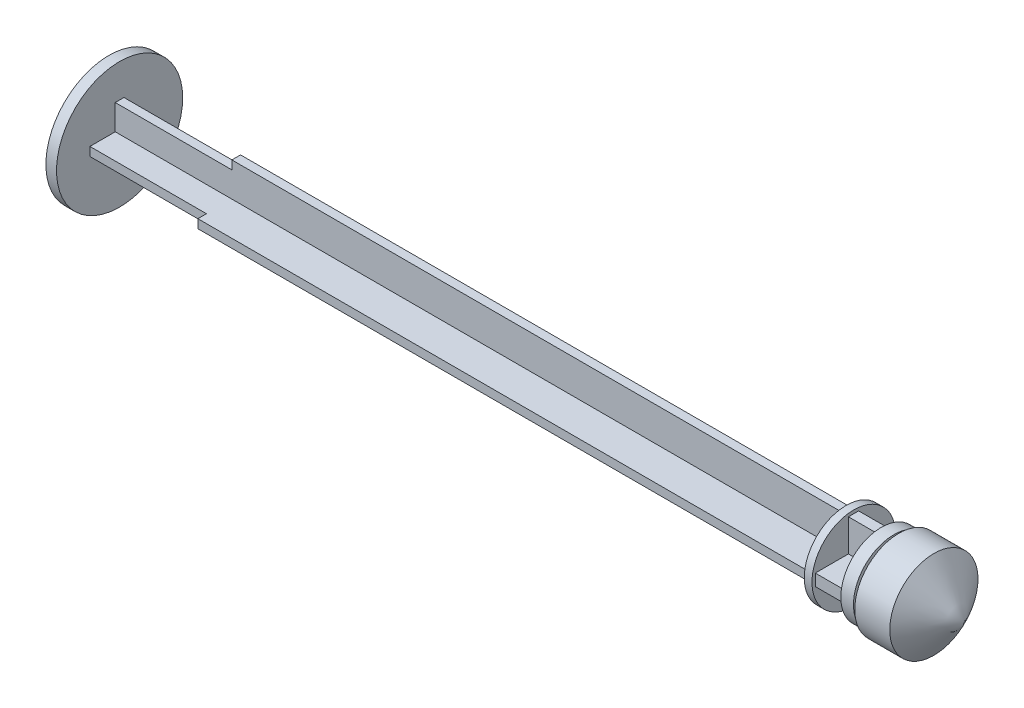
from build123d import *

# Parameters (mm, degrees)
SKETCH1_R            = 6.235
BOSS_EXTRUDE1_DEPTH  = 1.05
SKETCH2_W            = 5.87
SKETCH2_H            = 0.86
SKETCH2_W_2          = 0.86
SKETCH2_H_2          = 5.87
BOSS_EXTRUDE5_DEPTH  = 11.52
SKETCH10_W           = 0.86
SKETCH10_H           = 7.57
BOSS_EXTRUDE6_DEPTH  = 60.27
SKETCH11_W           = 7.57
SKETCH11_H           = 0.86
BOSS_EXTRUDE8_DEPTH  = 60.27
SKETCH15_R           = 4.13
BOSS_EXTRUDE9_DEPTH  = 0.76
SKETCH16_W           = 1.010303068
SKETCH16_H           = 7.6
SKETCH16_W_2         = 7.6
SKETCH16_H_2         = 1.157256242
BOSS_EXTRUDE10_DEPTH = 2.71
SKETCH17_R           = 3.99
BOSS_EXTRUDE11_DEPTH = 1.25
SKETCH18_W           = 2.18
SKETCH18_H           = 0.9
SKETCH18_W_2         = 0.9
SKETCH18_H_2         = 2.18
BOSS_EXTRUDE13_DEPTH = 0.5
SKETCH19_R           = 4.36
BOSS_EXTRUDE14_DEPTH = 3.46


with BuildPart() as part:
    # Sketch1 → Boss-Extrude1 (new body)
    with BuildSketch(Plane(origin=(0, 0, 0), x_dir=(0, 0, -1), z_dir=(1, 0, 0))):
        Circle(SKETCH1_R)
    extrude(amount=BOSS_EXTRUDE1_DEPTH)

    # Sketch2 → Boss-Extrude5 (add)
    with BuildSketch(Plane(origin=(1.05, 0, 0), x_dir=(0, 0, -1), z_dir=(1, 0, 0))):
        Rectangle(SKETCH2_W, SKETCH2_H)
        Rectangle(SKETCH2_W_2, SKETCH2_H_2)
    extrude(amount=BOSS_EXTRUDE5_DEPTH)

    # Sketch10 → Boss-Extrude6 (add)
    with BuildSketch(Plane(origin=(12.57, 0, 0), x_dir=(0, 0, -1), z_dir=(1, 0, 0))):
        Rectangle(SKETCH10_W, SKETCH10_H)
    extrude(amount=BOSS_EXTRUDE6_DEPTH)

    # Sketch11 → Boss-Extrude8 (add)
    with BuildSketch(Plane(origin=(12.57, 0, 0), x_dir=(0, 0, -1), z_dir=(1, 0, 0))):
        Rectangle(SKETCH11_W, SKETCH11_H)
    extrude(amount=BOSS_EXTRUDE8_DEPTH)

    # Sketch15 → Boss-Extrude9 (add)
    with BuildSketch(Plane(origin=(72.84, 0, 0), x_dir=(0, 0, -1), z_dir=(1, 0, 0))):
        Circle(SKETCH15_R)
    extrude(amount=BOSS_EXTRUDE9_DEPTH)

    # Sketch16 → Boss-Extrude10 (add)
    with BuildSketch(Plane(origin=(73.6, 0, 0), x_dir=(0, 0, -1), z_dir=(1, 0, 0))):
        with Locations((-0.018369147, 0)):
            Rectangle(SKETCH16_W, SKETCH16_H)
        with Locations((0, 0.045922867)):
            Rectangle(SKETCH16_W_2, SKETCH16_H_2)
    extrude(amount=BOSS_EXTRUDE10_DEPTH)

    # Sketch17 → Boss-Extrude11 (add)
    with BuildSketch(Plane(origin=(76.31, 0, 0), x_dir=(0, 0, -1), z_dir=(1, 0, 0))):
        Circle(SKETCH17_R)
    extrude(amount=BOSS_EXTRUDE11_DEPTH)

    # Sketch18 → Boss-Extrude13 (add)
    with BuildSketch(Plane(origin=(77.56, 0, 0), x_dir=(0, 0, -1), z_dir=(1, 0, 0))):
        with Locations((1.54, 0)):
            Rectangle(SKETCH18_W, SKETCH18_H)
        with Locations((0, 1.54)):
            Rectangle(SKETCH18_W_2, SKETCH18_H_2)
        with Locations((-1.54, 0)):
            Rectangle(SKETCH18_W, SKETCH18_H)
        Rectangle(SKETCH18_W_2, SKETCH18_H)
        with Locations((0, -1.54)):
            Rectangle(SKETCH18_W_2, SKETCH18_H_2)
    extrude(amount=BOSS_EXTRUDE13_DEPTH)

    # Sketch19 → Boss-Extrude14 (add)
    with BuildSketch(Plane(origin=(78.06, 0, 0), x_dir=(0, 0, -1), z_dir=(1, 0, 0))):
        Circle(SKETCH19_R)
    extrude(amount=BOSS_EXTRUDE14_DEPTH)

    # Boss-Extrude15 cone 1 section (through the dimple's axis) → Boss-Extrude15 (revolve)
    with BuildSketch(Plane(origin=(81.52, 0, 0), x_dir=(0, 0, 1), z_dir=(0, 1, 0))):
        Polygon((0, 0), (4.36, 0), (0, 3.052904867), align=None)
    revolve(axis=Axis((81.52, 0, 0), (1, 0, 0)))


solid = part.part
